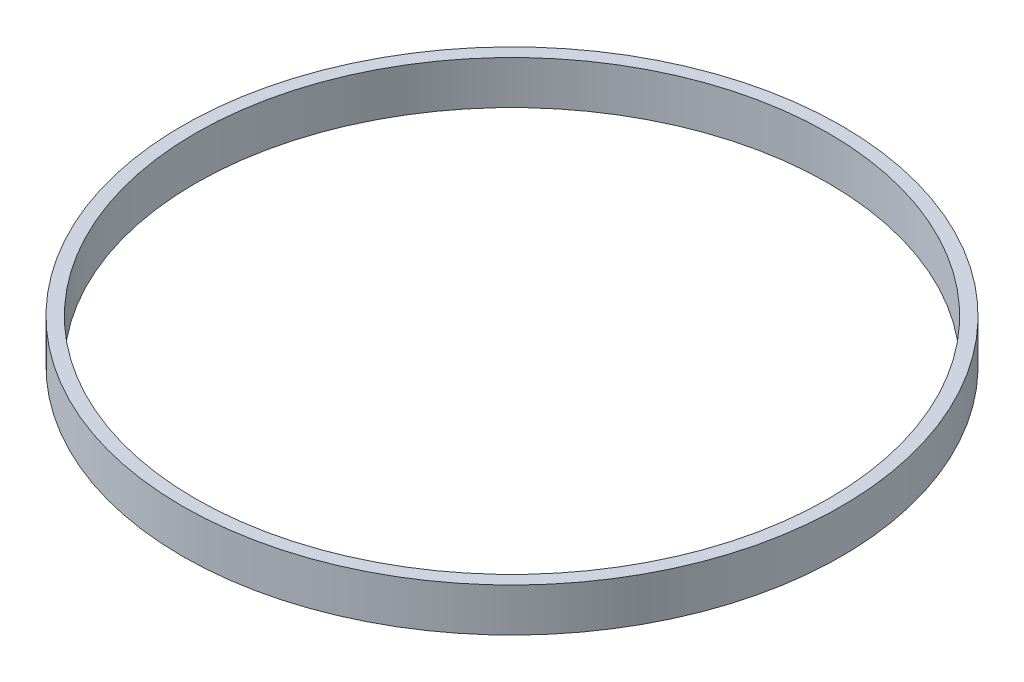
from build123d import *

# Parameters (mm, degrees)
CROQUIS1_R              = 76
CROQUIS1_R_2            = 73
SALIENTE_EXTRUIR1_DEPTH = 10


with BuildPart() as part:
    # Croquis1 → Saliente-Extruir1 (new body)
    with BuildSketch(Plane(origin=(0, 0, 0), x_dir=(1, 0, 0), z_dir=(0, 1, 0))):
        with Locations(Location((0, 0, 0), (0, 0, 270))):
            Circle(CROQUIS1_R)
        with Locations(Location((0, 0, 0), (0, 0, 270))):
            Circle(CROQUIS1_R_2, mode=Mode.SUBTRACT)
    extrude(amount=SALIENTE_EXTRUIR1_DEPTH)


solid = part.part
